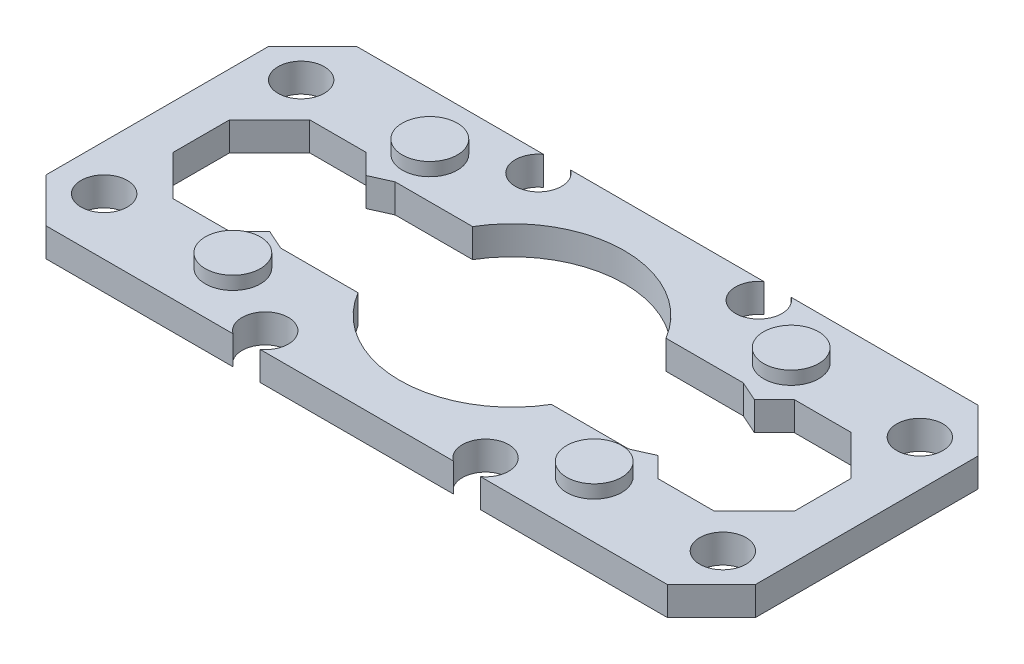
from build123d import *

# Parameters (mm, degrees)
SKETCH1_R           = 1.3335
SKETCH1_R_2         = 1.5875
BOSS_EXTRUDE1_DEPTH = 1.651
CHAMFER1_SIZE       = 2.54
SKETCH1_2_R         = 1.5875
BOSS_EXTRUDE2_DEPTH = 2.413
SKETCH1_3_R         = 1.5875
CUT_EXTRUDE1_DEPTH  = 0.889
CUT_EXTRUDE2_DEPTH  = 23.382376376


with BuildPart() as part:
    # Sketch1 → Boss-Extrude1 (new body)
    with BuildSketch(Plane(origin=(0, 0, 0), x_dir=(1, 0, 0), z_dir=(0, 1, 0))):
        with BuildLine():
            Line((-5.567119422, 8.9535), (5.567119422, 8.9535))
            ThreePointArc((5.567119422, 8.9535), (6.35, 6.5405), (7.132880578, 8.9535))
            Line((7.132880578, 8.9535), (20.447, 8.9535))
            Line((20.447, 8.9535), (20.447, -8.9535))
            Line((20.447, -8.9535), (7.132880578, -8.9535))
            ThreePointArc((7.132880578, -8.9535), (6.35, -6.5405), (5.567119422, -8.9535))
            Line((5.567119422, -8.9535), (-5.567119422, -8.9535))
            ThreePointArc((-5.567119422, -8.9535), (-6.35, -6.5405), (-7.132880578, -8.9535))
            Line((-7.132880578, -8.9535), (-20.447, -8.9535))
            Line((-20.447, -8.9535), (-20.447, 8.9535))
            Line((-20.447, 8.9535), (-7.132880578, 8.9535))
            ThreePointArc((-7.132880578, 8.9535), (-6.35, 6.5405), (-5.567119422, 8.9535))
        make_face()
        with Locations((-17.8308, 5.6769)):
            Circle(SKETCH1_R, mode=Mode.SUBTRACT)
        with Locations((17.8308, 5.6769)):
            Circle(SKETCH1_R, mode=Mode.SUBTRACT)
        with Locations((17.8308, -5.6769)):
            Circle(SKETCH1_R, mode=Mode.SUBTRACT)
        with Locations((-17.8308, -5.6769)):
            Circle(SKETCH1_R, mode=Mode.SUBTRACT)
        with Locations((-10.414, 5.6769)):
            Circle(SKETCH1_R_2, mode=Mode.SUBTRACT)
        with Locations((10.414, 5.6769)):
            Circle(SKETCH1_R_2, mode=Mode.SUBTRACT)
        with Locations((10.414, -5.6769)):
            Circle(SKETCH1_R_2, mode=Mode.SUBTRACT)
        with Locations((-10.414, -5.6769)):
            Circle(SKETCH1_R_2, mode=Mode.SUBTRACT)
    extrude(amount=BOSS_EXTRUDE1_DEPTH)

    # Chamfer1
    chamfer1_edges = [part.edges().sort_by_distance(p)[0] for p in [
        (-20.447, 0.8255, 8.9535),
        (-20.447, 0.8255, -8.9535),
        (20.447, 0.8255, -8.9535),
        (20.447, 0.8255, 8.9535),
    ]]
    chamfer(chamfer1_edges, length=CHAMFER1_SIZE)

    # Sketch1<2> → Boss-Extrude2 (add)
    with BuildSketch(Plane(origin=(0, 0, 0), x_dir=(1, 0, 0), z_dir=(0, 1, 0))):
        with Locations((-10.414, 5.6769)):
            Circle(SKETCH1_2_R)
        with Locations((10.414, 5.6769)):
            Circle(SKETCH1_2_R)
        with Locations((10.414, -5.6769)):
            Circle(SKETCH1_2_R)
        with Locations((-10.414, -5.6769)):
            Circle(SKETCH1_2_R)
    extrude(amount=BOSS_EXTRUDE2_DEPTH)

    # Sketch1<3> → Cut-Extrude1 (cut)
    with BuildSketch(Plane(origin=(0, 0, 0), x_dir=(1, 0, 0), z_dir=(0, 1, 0))):
        with Locations((-10.414, 5.6769)):
            Circle(SKETCH1_3_R)
        with Locations((10.414, 5.6769)):
            Circle(SKETCH1_3_R)
        with Locations((10.414, -5.6769)):
            Circle(SKETCH1_3_R)
        with Locations((-10.414, -5.6769)):
            Circle(SKETCH1_3_R)
    extrude(amount=CUT_EXTRUDE1_DEPTH, mode=Mode.SUBTRACT)

    # Sketch2 → Cut-Extrude2 (cut, through all)
    with BuildSketch(Plane(origin=(0, 1.651, 0), x_dir=(1, 0, 0), z_dir=(0, 1, 0))):
        with BuildLine():
            Line((-17.907, 1.630758795), (-17.907, -1.630758795))
            Line((-17.907, -1.630758795), (-15.600758795, -3.937))
            Line((-15.600758795, -3.937), (-12.339241205, -3.937))
            Line((-12.339241205, -3.937), (-11.186120602, -2.783879398))
            Line((-11.186120602, -2.783879398), (-10.033, -3.302))
            Line((-10.033, -3.302), (-5.572102386, -3.302))
            ThreePointArc((-5.572102386, -3.302), (0, -6.477), (5.572102386, -3.302))
            Line((5.572102386, -3.302), (10.033, -3.302))
            Line((10.033, -3.302), (11.186120602, -2.783879398))
            Line((11.186120602, -2.783879398), (12.339241205, -3.937))
            Line((12.339241205, -3.937), (15.600758795, -3.937))
            Line((15.600758795, -3.937), (17.907, -1.630758795))
            Line((17.907, -1.630758795), (17.907, 1.630758795))
            Line((17.907, 1.630758795), (15.600758795, 3.937))
            Line((15.600758795, 3.937), (12.339241205, 3.937))
            Line((12.339241205, 3.937), (11.186120602, 2.783879398))
            Line((11.186120602, 2.783879398), (10.033, 3.302))
            Line((10.033, 3.302), (5.572102386, 3.302))
            ThreePointArc((5.572102386, 3.302), (0, 6.477), (-5.572102386, 3.302))
            Line((-5.572102386, 3.302), (-10.033, 3.302))
            Line((-10.033, 3.302), (-11.186120602, 2.783879398))
            Line((-11.186120602, 2.783879398), (-12.339241205, 3.937))
            Line((-12.339241205, 3.937), (-15.600758795, 3.937))
            Line((-15.600758795, 3.937), (-17.907, 1.630758795))
        make_face()
    extrude(amount=-CUT_EXTRUDE2_DEPTH, mode=Mode.SUBTRACT)


solid = part.part
